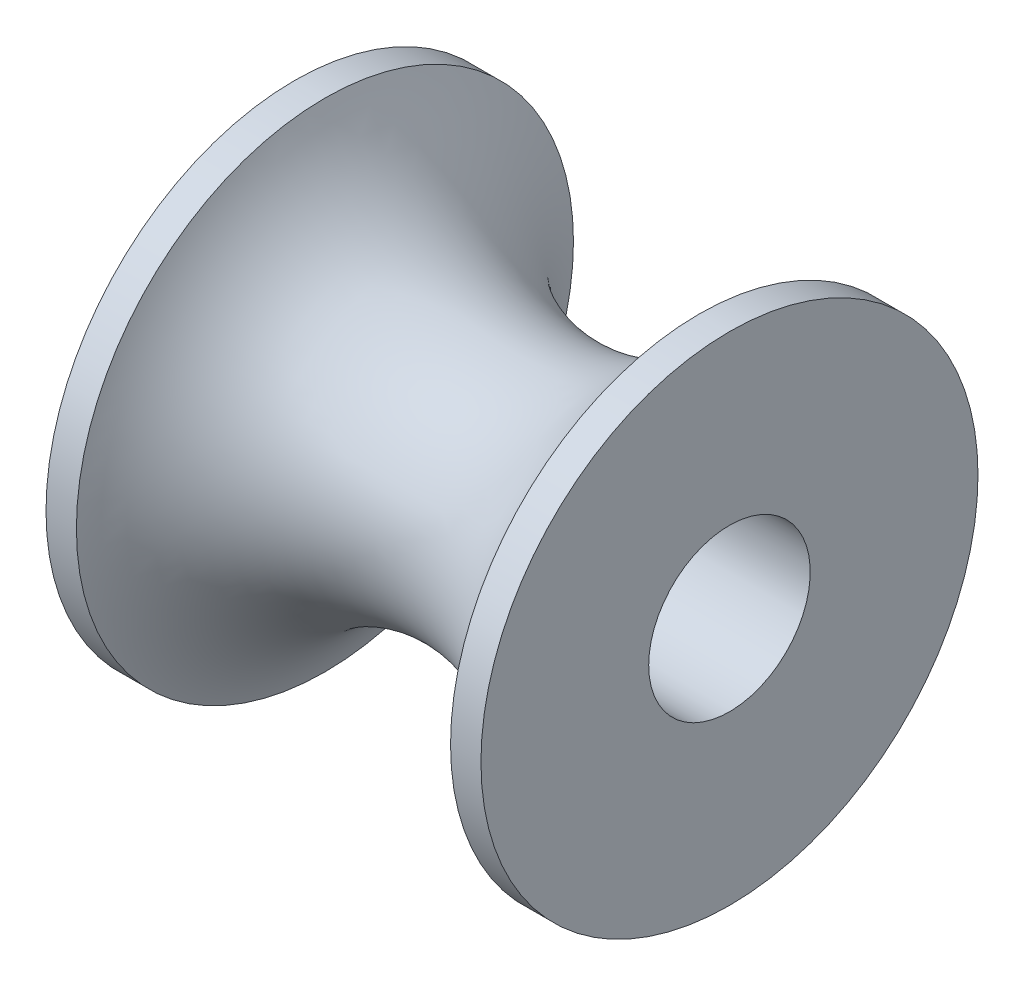
from build123d import *

# Parameters (mm, degrees)
SKETCH3_R          = 2.6
CUT_EXTRUDE1_DEPTH = 19


with BuildPart() as part:
    # Sketch2 → Revolve2 (revolve)
    with BuildSketch(Plane(origin=(0, 0, 0), x_dir=(1, 0, 0), z_dir=(0, 1, 0)), mode=Mode.PRIVATE) as revolve2_sk:
        with BuildLine():
            Line((0, 0), (14, 0))
            Line((14, 0), (14, 8))
            Line((14, 8), (13.021433052, 8))
            ThreePointArc((13.021433052, 8), (7, 3.94792647), (0.978566948, 8))
            Line((0.978566948, 8), (0, 8))
            Line((0, 8), (0, 0))
        make_face()
    revolve(revolve2_sk.sketch.rotate(Axis((0, 0, 0), (1, 0, 0)), 180), axis=Axis((0, 0, 0), (1, 0, 0)))

    # Sketch3 → Cut-Extrude1 (cut, through all)
    with BuildSketch(Plane.ZY):
        Circle(SKETCH3_R)
    extrude(amount=-CUT_EXTRUDE1_DEPTH, mode=Mode.SUBTRACT)


solid = part.part
